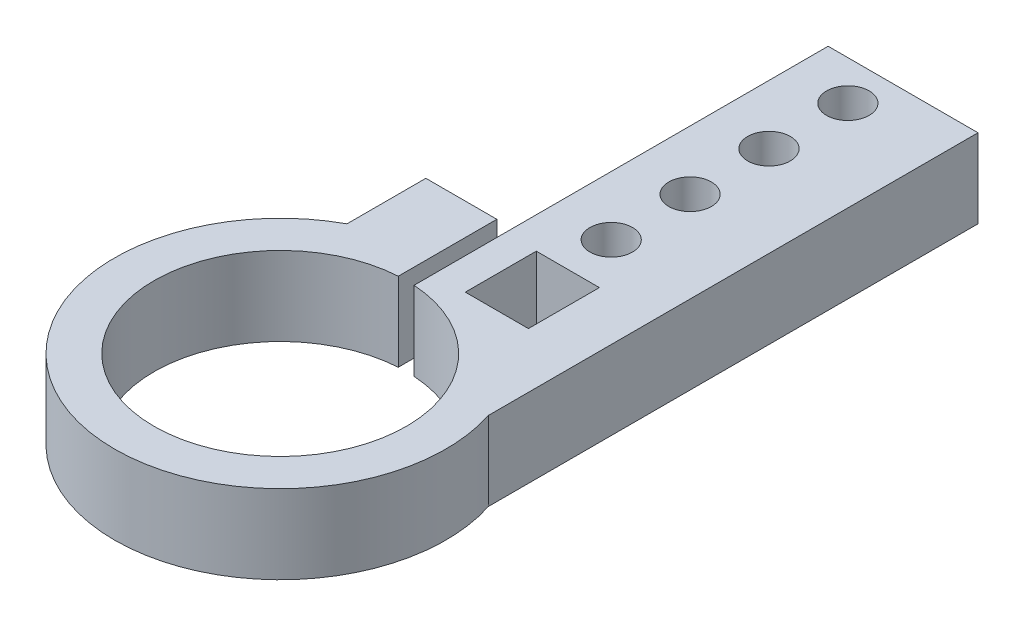
from build123d import *

# Parameters (mm, degrees)
SKETCH1_R           = 26.67
SKETCH1_R_2         = 20.32
BOSS_EXTRUDE1_DEPTH = 12.7
SKETCH2_W           = 25.4
SKETCH2_H           = 12.7
BOSS_EXTRUDE2_DEPTH = 12.7
SKETCH4_W           = 2.54
SKETCH4_H           = 58.988343485
CUT_EXTRUDE2_DEPTH  = 47.685650963
BOSS_EXTRUDE3_REACH = 69.639
BOSS_EXTRUDE3_START = 12.7
SKETCH5_W           = 36.152055347
SKETCH5_H           = 12.7
SKETCH6_W           = 24.13
SKETCH6_H           = 50.8
BOSS_EXTRUDE4_DEPTH = 12.7
SKETCH7_R           = 3.429
SKETCH7_W           = 10.16
SKETCH7_H           = 11.43
CUT_EXTRUDE3_DEPTH  = 92.832667548


with BuildPart() as part:
    # Sketch1 → Boss-Extrude1 (new body)
    with BuildSketch(Plane(origin=(0, 0, 0), x_dir=(1, 0, 0), z_dir=(0, 1, 0))):
        with Locations(Location((0, 0, 0), (0, 0, 270))):
            Circle(SKETCH1_R)
        with Locations(Location((0, 0, 0), (0, 0, 270))):
            Circle(SKETCH1_R_2, mode=Mode.SUBTRACT)
    extrude(amount=BOSS_EXTRUDE1_DEPTH)

    # Sketch2 → Boss-Extrude2 (add)
    with BuildSketch(Plane(origin=(0, 0, 0), x_dir=(1, 0, 0), z_dir=(0, 1, 0))):
        with Locations((0, 29.802055347)):
            Rectangle(SKETCH2_W, SKETCH2_H)
    extrude(amount=BOSS_EXTRUDE2_DEPTH)

    # Sketch4 → Cut-Extrude2 (cut, through all)
    with BuildSketch(Plane(origin=(0, 0, 0), x_dir=(1, 0, 0), z_dir=(0, 1, 0))):
        with Locations((0, 30.925816426)):
            Rectangle(SKETCH4_W, SKETCH4_H)
    extrude(amount=CUT_EXTRUDE2_DEPTH, mode=Mode.SUBTRACT)

    # Sketch5 → Boss-Extrude3 (add, up to next)
    with BuildSketch(Plane(origin=(12.7, 0, 0), x_dir=(0, 0, -1), z_dir=(1, 0, 0)).offset(BOSS_EXTRUDE3_START), mode=Mode.PRIVATE) as boss_extrude3_sk1:
        with Locations((18.076027674, 6.35)):
            Rectangle(SKETCH5_W, SKETCH5_H)
    boss_extrude3_tool1 = extrude(boss_extrude3_sk1.sketch, amount=-BOSS_EXTRUDE3_REACH, mode=Mode.PRIVATE) - part.part
    add(boss_extrude3_tool1.solids().sort_by_distance((25.4, 6.35, -18.076028))[0])

    # Sketch6 → Boss-Extrude4 (add)
    with BuildSketch(Plane(origin=(0, 12.7, 0), x_dir=(1, 0, 0), z_dir=(0, 1, 0))):
        with Locations((13.335, 61.552055347)):
            Rectangle(SKETCH6_W, SKETCH6_H)
    extrude(amount=-BOSS_EXTRUDE4_DEPTH)

    # Sketch7 → Cut-Extrude3 (cut, through all)
    with BuildSketch(Plane(origin=(0, 0, 0), x_dir=(1, 0, 0), z_dir=(0, 1, 0))):
        with Locations(Location((10.795, 80.602055347, 0), (0, 0, 270))):
            Circle(SKETCH7_R)
        with Locations((36.195, 80.602055347)):
            Circle(SKETCH7_R)
        with Locations((36.195, 67.902055347)):
            Circle(SKETCH7_R)
        with Locations(Location((10.795, 67.902055347, 0), (0, 0, 270))):
            Circle(SKETCH7_R)
        with Locations(Location((10.795, 55.202055347, 0), (0, 0, 270))):
            Circle(SKETCH7_R)
        with Locations((36.195, 55.202055347)):
            Circle(SKETCH7_R)
        with Locations(Location((10.795, 42.502055347, 0), (0, 0, 270))):
            Circle(SKETCH7_R)
        with Locations((36.195, 42.502055347)):
            Circle(SKETCH7_R)
        with Locations((11.43, 29.167055347)):
            Rectangle(SKETCH7_W, SKETCH7_H)
    extrude(amount=CUT_EXTRUDE3_DEPTH, mode=Mode.SUBTRACT)


solid = part.part
